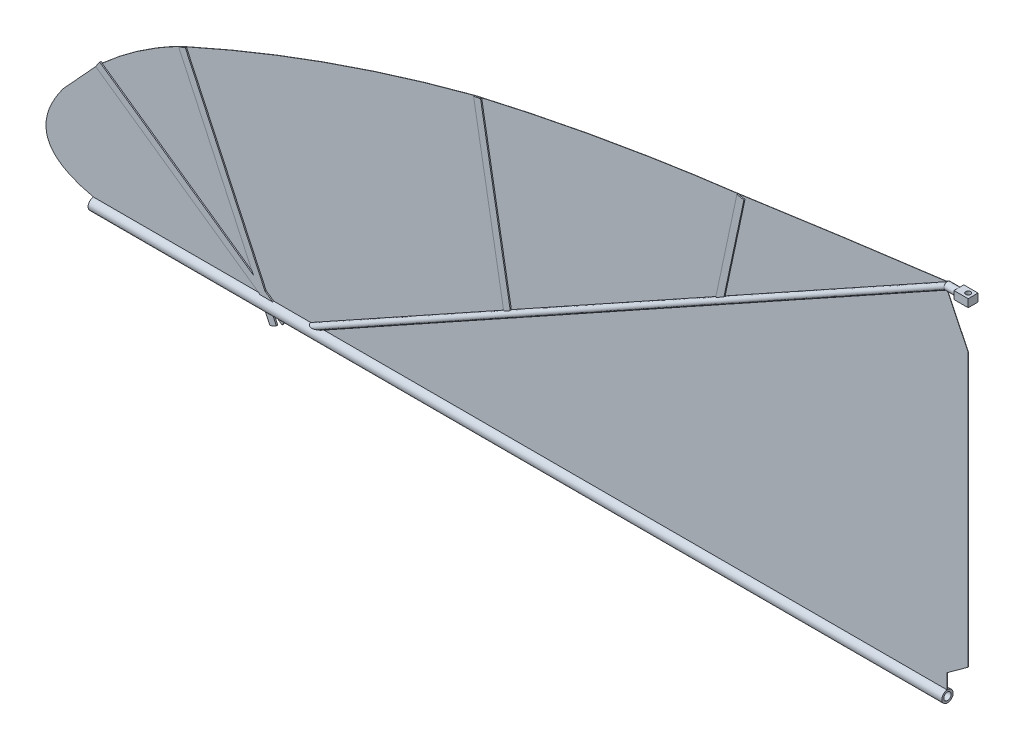
from build123d import *

# Parameters (mm, degrees)
SKETCH2_R            = 4
SKETCH2_R_2          = 2.6
SKETCH4_R            = 2.5
BOSS_EXTRUDE1_DEPTH  = 0.2
EXTRUDE_THIN1_DEPTH  = 1
BOSS_EXTRUDE5_DEPTH  = 0.2
BOSS_EXTRUDE8_DEPTH  = 0.2
SKETCH10_R           = 2.5
BOSS_EXTRUDE13_DEPTH = 8
SKETCH11_W           = 6.909348158
SKETCH11_H           = 5.526262888
BOSS_EXTRUDE14_DEPTH = 10
SKETCH13_R           = 1.743417083
CUT_EXTRUDE1_DEPTH   = 7


with BuildPart() as part:
    # Sweep1: sweep along a path in Sketch1
    with BuildLine(Plane.XY) as sweep1_path:
        Line((-300, 0), (300, 0))
    # Sketch2 → Sweep1 (sweep)
    with BuildSketch(Plane(origin=(-300, 0, 0), x_dir=(0, 0, -1), z_dir=(1, 0, 0))):
        Circle(SKETCH2_R)
        Circle(SKETCH2_R_2, mode=Mode.SUBTRACT)
    sweep(path=sweep1_path.line)

    # Sweep2: sweep along a path in Sketch3
    with BuildLine(Plane.XY) as sweep2_path:
        Line((-150, 0), (300, 250))
    # Sketch4 → Sweep2 (sweep)
    with BuildSketch(Plane(origin=(300, 0, 0), x_dir=(0, 0, -1), z_dir=(1, 0, 0))):
        with Locations((0, 250)):
            Circle(SKETCH4_R)
    sweep(path=sweep2_path.line)

    # Sketch10 → Boss-Extrude13 (add)
    with BuildSketch(Plane(origin=(300, 0, 0), x_dir=(0, 0, -1), z_dir=(1, 0, 0))):
        with Locations((0, 250)):
            Circle(SKETCH10_R)
    extrude(amount=BOSS_EXTRUDE13_DEPTH)

    # Sketch11 → Boss-Extrude14 (add)
    with BuildSketch(Plane(origin=(308, 0, 0), x_dir=(0, 0, -1), z_dir=(1, 0, 0))):
        with Locations((0, 250)):
            Rectangle(SKETCH11_W, SKETCH11_H)
    extrude(amount=BOSS_EXTRUDE14_DEPTH)

    # Sketch13 → Cut-Extrude1 (cut)
    with BuildSketch(Plane(origin=(0, 252.763131444, 0), x_dir=(1, 0, 0), z_dir=(0, 1, 0))):
        with Locations((314.5, 0)):
            Circle(SKETCH13_R)
    extrude(amount=-CUT_EXTRUDE1_DEPTH, mode=Mode.SUBTRACT)


with BuildPart() as body_2:
    # Sketch5 → Boss-Extrude1 (new body)
    with BuildSketch(Plane.XY):
        with BuildLine():
            Line((-182.605855926, 4.424294622), (-181.999900407, 4))
            Line((-181.999900407, 4), (-147.3, 4))
            Line((-147.3, 4), (300, 252.5))
            add(Edge.make_bspline(
                [(153.020599332, 232.578688898), (226.42076394, 243.201142234), (300, 252.5)],
                knots=[0, 0, 0, 1, 1, 1], degree=2))
            add(Edge.make_bspline(
                [(-32.087705813, 199.761962151), (59.582042368, 221.098060394), (153.020599332, 232.578688898)],
                knots=[0, 0, 0, 1, 1, 1], degree=2))
            add(Edge.make_bspline(
                [(-239.297538389, 126), (-138.889749708, 171.747052515), (-32.087705813, 199.761962151)],
                knots=[0, 0, 0, 1, 1, 1], degree=2))
            add(Edge.make_bspline(
                [(-297.712826784, 85.023063317), (-271.377288529, 109.624818441), (-239.297538389, 126)],
                knots=[0, 0, 0, 1, 1, 1], degree=2))
            Line((-297.712826784, 85.023063317), (-321.326441997, 59.306361284))
            add(Edge.make_bspline(
                [(-300, 4), (-353.454401098, 15.63308285), (-321.326441997, 59.306361284)],
                knots=[0, 0, 0, 1, 1, 1], degree=2))
            Line((-300, 4), (-182.408004094, 4))
            Line((-182.408004094, 4), (-182.605855926, 4.424294622))
        make_face()
    extrude(amount=BOSS_EXTRUDE1_DEPTH)

    # Sketch5<3> → Extrude-Thin1 (add)
    with BuildSketch(Plane.XY):
        Polygon((-166.648499698, -6.749166499), (-297.712826784, 85.023063317), (-294.844944602, 89.118823539), (-163.780617516, -2.653406277), align=None)
        Polygon((-175.18430209, -11.491278939), (-239.297538389, 126), (-234.765999454, 128.113091309), (-170.652763155, -9.37818763), align=None)
        Polygon((-10.928468128, 79.761962151), (-32.087705813, 199.761962151), (-27.163667048, 200.630203039), (-6.004429363, 80.630203039), align=None)
        Polygon((138.141640016, 162.578688898), (153.020599332, 232.578688898), (157.911337336, 231.539130443), (143.032378019, 161.539130443), align=None)
    extrude(amount=EXTRUDE_THIN1_DEPTH)


with BuildPart() as body_3:
    # Sketch6 → Boss-Extrude5 (new body)
    with BuildSketch(Plane.XY):
        Polygon((300, 4), (300, 247.5), (-138.3, 4), align=None)
    extrude(amount=BOSS_EXTRUDE5_DEPTH)

    # Sketch8 → Boss-Extrude8 (add)
    with BuildSketch(Plane.XY):
        Polygon((314.67349594, 216.981159788), (300, 247.5), (300, 14.513908711), (314.67349594, 25.150660034), align=None)
    extrude(amount=BOSS_EXTRUDE8_DEPTH)


solid = Compound([part.part, body_2.part, body_3.part])
